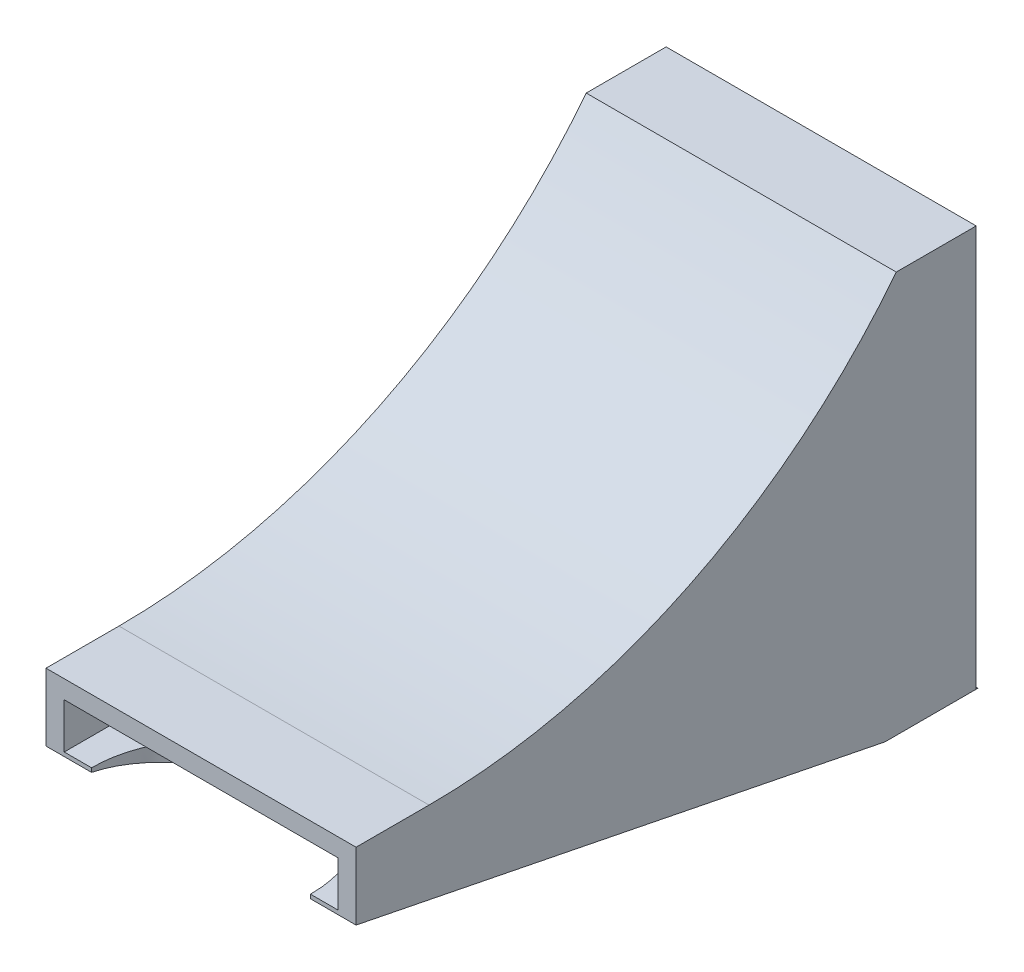
from build123d import *

# Parameters (mm, degrees)
SKETCH1_W           = 17
SKETCH1_H           = 22
SKETCH1_W_2         = 15
SKETCH1_H_2         = 20
BOSS_EXTRUDE1_DEPTH = 30
SKETCH2_R           = 32.5
CUT_EXTRUDE1_DEPTH  = 37.193922142
BOSS_EXTRUDE2_REACH = 38.194
CUT_EXTRUDE2_DEPTH  = 37.193922142
BOSS_EXTRUDE3_START = -17
BOSS_EXTRUDE3_DEPTH = 17
SKETCH6_W           = 17
SKETCH6_H           = 4.5
SKETCH6_W_2         = 15
SKETCH6_H_2         = 2.480196097
BOSS_EXTRUDE4_DEPTH = 4
CUT_EXTRUDE3_DEPTH  = 40.572717875
CUT_EXTRUDE4_REACH  = 41.807
SKETCH8_R           = 6


with BuildPart() as part:
    # Sketch1 → Boss-Extrude1 (new body)
    with BuildSketch(Plane.XY):
        Rectangle(SKETCH1_W, SKETCH1_H)
        Rectangle(SKETCH1_W_2, SKETCH1_H_2, mode=Mode.SUBTRACT)
    extrude(amount=BOSS_EXTRUDE1_DEPTH)

    # Sketch2 → Cut-Extrude1 (cut, through all)
    with BuildSketch(Plane(origin=(8.5, 0, 0), x_dir=(0, 0, -1), z_dir=(1, 0, 0))):
        with Locations((-30, 31)):
            Circle(SKETCH2_R)
    extrude(amount=-CUT_EXTRUDE1_DEPTH, mode=Mode.SUBTRACT)

    # Sketch3 → Boss-Extrude2 (add, up to next)
    with BuildSketch(Plane(origin=(8.5, 0, 0), x_dir=(0, 0, -1), z_dir=(1, 0, 0)), mode=Mode.PRIVATE) as boss_extrude2_sk1:
        with BuildLine():
            Line((-30, -1.5), (-30, -2.5))
            ThreePointArc((-30, -2.5), (-14.962546758, 1.064653), (-3.125290699, 11))
            Line((-3.125290699, 11), (-4.382623085, 11))
            ThreePointArc((-4.382623085, 11), (-15.747807186, 1.791696386), (-30, -1.5))
        make_face()
    boss_extrude2_tool1 = extrude(boss_extrude2_sk1.sketch, amount=-BOSS_EXTRUDE2_REACH, mode=Mode.PRIVATE) - part.part
    add(boss_extrude2_tool1.solids().sort_by_distance((8.5, 1.521408, 15.61592))[0])

    # Sketch4 → Cut-Extrude2 (cut, through all)
    with BuildSketch(Plane.ZY.offset(8.5)):
        Polygon((5, -11), (30, -6), (30, -11), align=None)
    extrude(amount=-CUT_EXTRUDE2_DEPTH, mode=Mode.SUBTRACT)

    # Sketch5 → Boss-Extrude3 (add)
    with BuildSketch(Plane.ZY.offset(8.5).offset(BOSS_EXTRUDE3_START)):
        Polygon((5, -11), (30, -6), (30, -4.980196097), (-0.099019514, -11), align=None)
    extrude(amount=BOSS_EXTRUDE3_DEPTH)

    # Sketch6 → Boss-Extrude4 (add)
    with BuildSketch(Plane.XY.offset(30)):
        with Locations((0, -3.75)):
            Rectangle(SKETCH6_W, SKETCH6_H)
        with Locations((0, -3.740098049)):
            Rectangle(SKETCH6_W_2, SKETCH6_H_2, mode=Mode.SUBTRACT)
    extrude(amount=BOSS_EXTRUDE4_DEPTH)

    # Sketch7 → Cut-Extrude3 (cut, through all)
    with BuildSketch(Plane.ZY.offset(8.5)):
        Polygon((24, -7.2), (34, -5.2), (34, -7.2), align=None)
    extrude(amount=-CUT_EXTRUDE3_DEPTH, mode=Mode.SUBTRACT)

    # Sketch8 → Cut-Extrude4 (cut, up to next)
    with BuildSketch(Plane(origin=(0, -11.538461538, 2.307692308), x_dir=(1, 0, 0), z_dir=(0, -0.9805806756909202, 0.19611613513818413)), mode=Mode.PRIVATE) as cut_extrude4_sk1:
        with Locations((0, 32.319939071)):
            Circle(SKETCH8_R)
    cut_extrude4_tool1 = extrude(cut_extrude4_sk1.sketch, amount=-CUT_EXTRUDE4_REACH, mode=Mode.PRIVATE) & part.part
    add(cut_extrude4_tool1.solids().sort_by_distance((0, -5.2, 34))[0], mode=Mode.SUBTRACT)


solid = part.part
